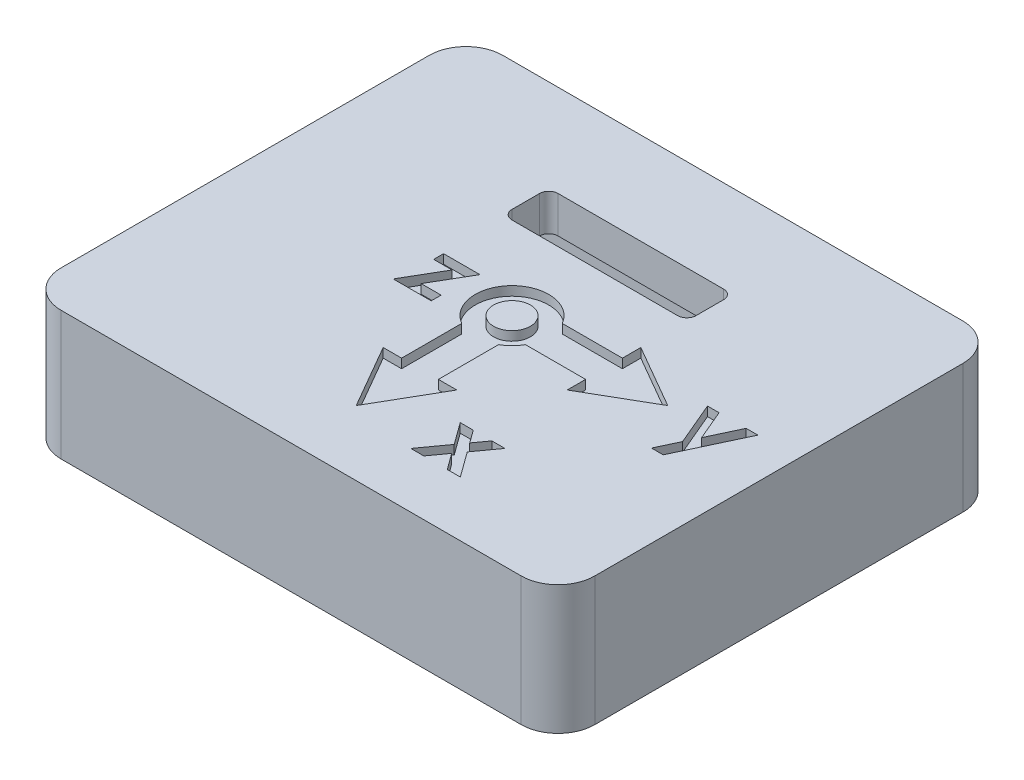
from build123d import *

# Parameters (mm, degrees)
SKETCH1_W           = 29
SKETCH1_H           = 24
BOSS_EXTRUDE1_DEPTH = 2
SKETCH2_W           = 29
SKETCH2_H           = 24
SKETCH2_W_2         = 25
SKETCH2_H_2         = 20
BOSS_EXTRUDE2_DEPTH = 5
SKETCH3_W           = 10
SKETCH3_H           = 2.5
CUT_EXTRUDE1_DEPTH  = 2
SKETCH7_R           = 1
CUT_EXTRUDE2_DEPTH  = 0.5
CUT_EXTRUDE4_DEPTH  = 0.5
FILLET3_R           = 2
FILLET4_R           = 0.5


with BuildPart() as part:
    # Sketch1 → Boss-Extrude1 (new body)
    with BuildSketch(Plane(origin=(0, 0, 0), x_dir=(1, 0, 0), z_dir=(0, 1, 0))):
        Rectangle(SKETCH1_W, SKETCH1_H)
    extrude(amount=BOSS_EXTRUDE1_DEPTH)

    # Sketch2 → Boss-Extrude2 (add)
    with BuildSketch(Plane.XZ):
        Rectangle(SKETCH2_W, SKETCH2_H)
        Rectangle(SKETCH2_W_2, SKETCH2_H_2, mode=Mode.SUBTRACT)
    extrude(amount=BOSS_EXTRUDE2_DEPTH)

    # Sketch3 → Cut-Extrude1 (cut)
    with BuildSketch(Plane(origin=(0, 2, 0), x_dir=(1, 0, 0), z_dir=(0, 1, 0))):
        with Locations((0, 5.75)):
            Rectangle(SKETCH3_W, SKETCH3_H)
    extrude(amount=-CUT_EXTRUDE1_DEPTH, mode=Mode.SUBTRACT)

    # Sketch7 → Cut-Extrude2 (cut)
    with BuildSketch(Plane(origin=(0, 2, 0), x_dir=(1, 0, 0), z_dir=(0, 1, 0))):
        with BuildLine():
            Line((5, -2), (8.464101615, 0))
            Line((8.464101615, 0), (5, 2))
            Line((5, 2), (5, 1))
            Line((5, 1), (1.732050808, 1))
            ThreePointArc((1.732050808, 1), (-1.414213562, 1.414213562), (-1, -1.732050808))
            Line((-1, -1.732050808), (-1, -5))
            Line((-1, -5), (-2, -5))
            Line((-2, -5), (0, -8.464101615))
            Line((0, -8.464101615), (2, -5))
            Line((2, -5), (1, -5))
            Line((1, -5), (1, -1.732050808))
            ThreePointArc((1, -1.732050808), (1.414213562, -1.414213562), (1.732050808, -1))
            Line((1.732050808, -1), (5, -1))
            Line((5, -1), (5, -2))
        make_face()
        with Locations(Location((0, 0, 0), (0, 0, 270))):
            Circle(SKETCH7_R, mode=Mode.SUBTRACT)
    extrude(amount=-CUT_EXTRUDE2_DEPTH, mode=Mode.SUBTRACT)

    # Sketch10 → Cut-Extrude4 (cut)
    with BuildSketch(Plane(origin=(0, 2, 0), x_dir=(1, 0, 0), z_dir=(0, 1, 0))):
        Polygon((9.565905449, 1.057692308), (10.194811699, 1.057692308), (10.893129006, -0.587840545), (11.665765224, 1.057692308), (12.304487179, 1.057692308), (10.660356571, -2.442307692), (10.021634615, -2.442307692), (10.562199519, -1.291766827), align=None)
        Polygon((3.628305288, -6.442307692), (4.337139423, -6.442307692), (4.842648237, -7.139222756), (5.346053686, -6.442307692), (6.056290064, -6.442307692), (5.198818109, -7.630008013), (6.192307692, -9), (5.483473558, -9), (4.844751603, -8.120092147), (4.209535256, -9), (3.5, -9), (4.489282853, -7.629306891), align=None)
        Polygon((-4.775641026, 1.057692308), (-2.801282051, 1.057692308), (-3.977063301, -0.961538462), (-2.891025641, -0.961538462), (-2.891025641, -1.5), (-4.955128205, -1.5), (-3.780048077, 0.519230769), (-4.775641026, 0.519230769), align=None)
    extrude(amount=-CUT_EXTRUDE4_DEPTH, mode=Mode.SUBTRACT)

    # Fillet3
    fillet3_edges = [part.edges().sort_by_distance(p)[0] for p in [
        (12.5, -2.5, 10),
        (-12.5, -2.5, 10),
        (-12.5, -2.5, -10),
        (12.5, -2.5, -10),
        (14.5, -1.5, 12),
        (-14.5, -1.5, 12),
        (-14.5, -1.5, -12),
        (14.5, -1.5, -12),
    ]]
    fillet(fillet3_edges, radius=FILLET3_R)

    # Fillet4
    fillet4_edges = [part.edges().sort_by_distance(p)[0] for p in [
        (5, 1, -4.5),
        (5, 1, -7),
        (-5, 1, -7),
        (-5, 1, -4.5),
    ]]
    fillet(fillet4_edges, radius=FILLET4_R)


solid = part.part
